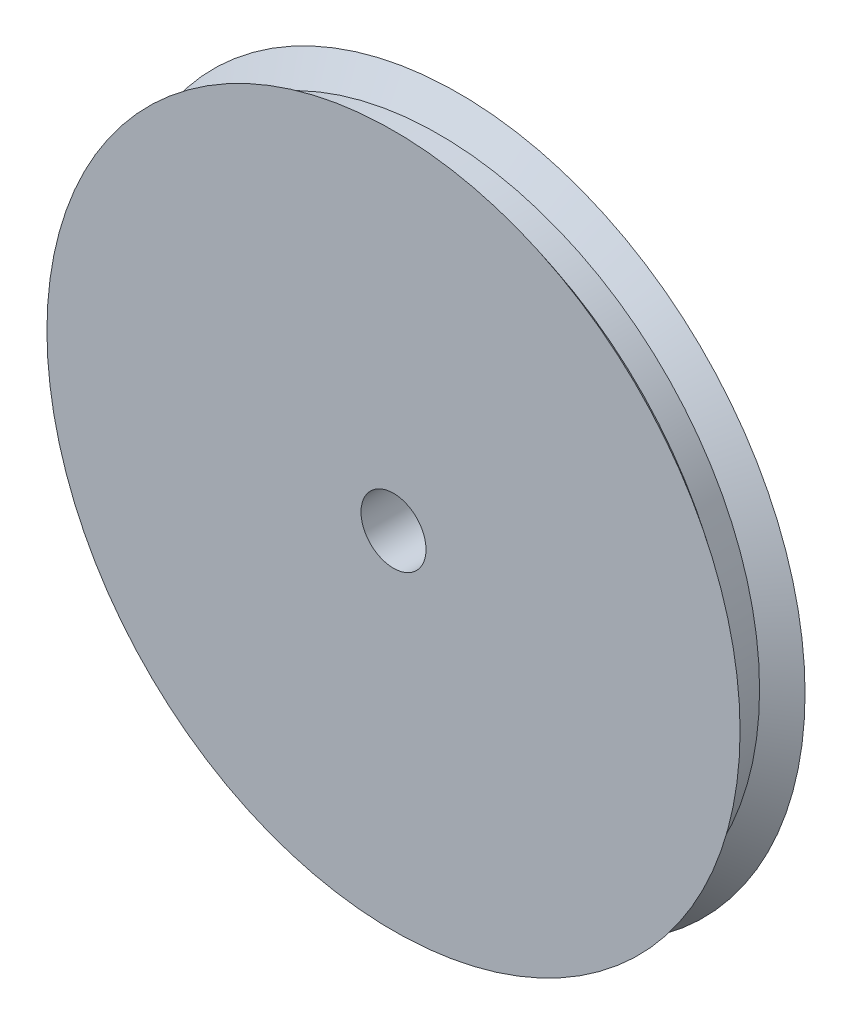
from build123d import *

# Parameters (mm, degrees)
SKETCH1_R               = 101.6
SKETCH1_R_2             = 9.525
BOSS_EXTRUDE1_DEPTH     = 19.05
BOSS_EXTRUDE2_START     = 6.35
SKETCH3_R               = 15.24
SKETCH3_R_2             = 9.525
BOSS_EXTRUDE2_DEPTH     = 6.35
CUT_EXTRUDE1_REACH      = 158.003
CUT_EXTRUDE1_END_RADIUS = 9.525
SKETCH5_R               = 1.27


with BuildPart() as part:
    # Sketch1 → Boss-Extrude1 (new body)
    with BuildSketch(Plane.XY):
        with Locations(Location((0, 0, 0), (0, 0, 180))):
            Circle(SKETCH1_R)
        with Locations(Location((0, 0, 0), (0, 0, 180))):
            Circle(SKETCH1_R_2, mode=Mode.SUBTRACT)
    extrude(amount=BOSS_EXTRUDE1_DEPTH)

    # Sketch2 → Cut-Revolve1 (revolve, cut)
    with BuildSketch(Plane(origin=(0, 0, 0), x_dir=(0, 0, -1), z_dir=(1, 0, 0)), mode=Mode.PRIVATE) as cut_revolve1_sk:
        Polygon((0, 101.6), (0, 104.858333469), (-19.05, 104.858333469), (-19.05, 101.6), (-13.335, 93.98), (-5.715, 93.98), align=None)
    revolve(cut_revolve1_sk.sketch.rotate(Axis((0, 0, 0), (0, 0, 1)), 90), axis=Axis((0, 0, 0), (0, 0, 1)), mode=Mode.SUBTRACT)

    # Sketch3 → Boss-Extrude2 (add)
    with BuildSketch(Plane(origin=(0, 0, 0), x_dir=(-1, 0, 0), z_dir=(0, 0, -1)).offset(BOSS_EXTRUDE2_START)):
        with Locations(Location((0, 0, 0), (0, 0, 180))):
            Circle(SKETCH3_R)
        Circle(SKETCH3_R_2, mode=Mode.SUBTRACT)
    extrude(amount=-BOSS_EXTRUDE2_DEPTH)

    # Cut-Extrude1: up to this cylinder (the profile starts outside it)
    cut_extrude1_end = Plane(origin=(0, 0, -3.175), z_dir=(0, 0, -1)) * Cylinder(CUT_EXTRUDE1_END_RADIUS, 336.056, mode=Mode.PRIVATE)
    # Sketch5 → Cut-Extrude1 (cut, up to the surface)
    with BuildSketch(Plane(origin=(15.24, 0, 0), x_dir=(0, 0, -1), z_dir=(1, 0, 0)), mode=Mode.PRIVATE) as cut_extrude1_sk1:
        with Locations((3.175, 0)):
            Circle(SKETCH5_R)
    cut_extrude1_tool1 = extrude(cut_extrude1_sk1.sketch, amount=-CUT_EXTRUDE1_REACH, mode=Mode.PRIVATE) - cut_extrude1_end
    add(cut_extrude1_tool1.solids().sort_by_distance((15.24, 0, -3.175))[0], mode=Mode.SUBTRACT)


solid = part.part
